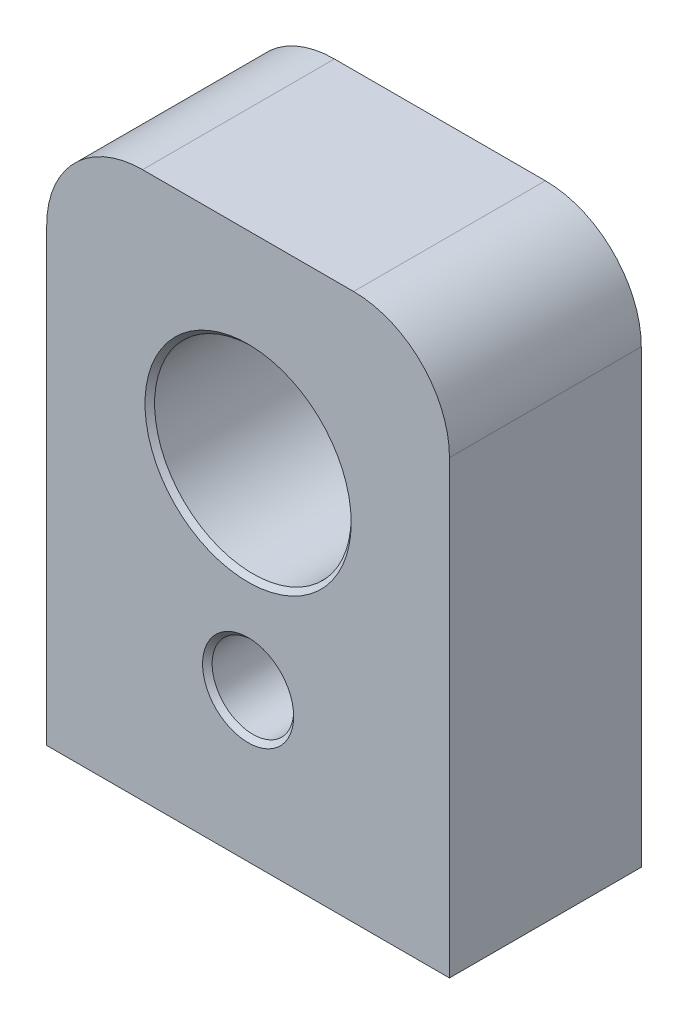
from build123d import *

# Parameters (mm, degrees)
SKETCH1_R           = 10.25
SKETCH1_R_2         = 4.25
BOSS_EXTRUDE1_DEPTH = 10
CHAMFER1_SIZE       = 0.5
CHAMFER2_SIZE       = 0.5


with BuildPart() as part:
    # Sketch1 → Boss-Extrude1 (new, symmetric)
    with BuildSketch(Plane.XY):
        with BuildLine():
            Line((-7.444896481, 30.480652594), (-29.444896481, 30.480652594))
            ThreePointArc((-29.444896481, 30.480652594), (-36.515964293, 27.551720406), (-39.444896481, 20.480652594))
            Line((-39.444896481, 20.480652594), (-39.444896481, -26.519347406))
            Line((-39.444896481, -26.519347406), (2.555103519, -26.519347406))
            Line((2.555103519, -26.519347406), (2.555103519, 20.480652594))
            ThreePointArc((2.555103519, 20.480652594), (-0.373828669, 27.551720406), (-7.444896481, 30.480652594))
        make_face()
        with Locations((-18.444896481, 9.480652594)):
            Circle(SKETCH1_R, mode=Mode.SUBTRACT)
        with Locations((-18.444896481, -11.019347406)):
            Circle(SKETCH1_R_2, mode=Mode.SUBTRACT)
    extrude(amount=BOSS_EXTRUDE1_DEPTH, both=True)

    # Chamfer1
    chamfer1_edges = [part.edges().sort_by_distance(p)[0] for p in [
        (-28.694896481, 9.480652594, -10),
        (-28.694896481, 9.480652594, 10),
    ]]
    chamfer(chamfer1_edges, length=CHAMFER1_SIZE)

    # Chamfer2
    chamfer2_edges = [part.edges().sort_by_distance(p)[0] for p in [
        (-22.694896481, -11.019347406, -10),
        (-22.694896481, -11.019347406, 10),
    ]]
    chamfer(chamfer2_edges, length=CHAMFER2_SIZE)


solid = part.part
